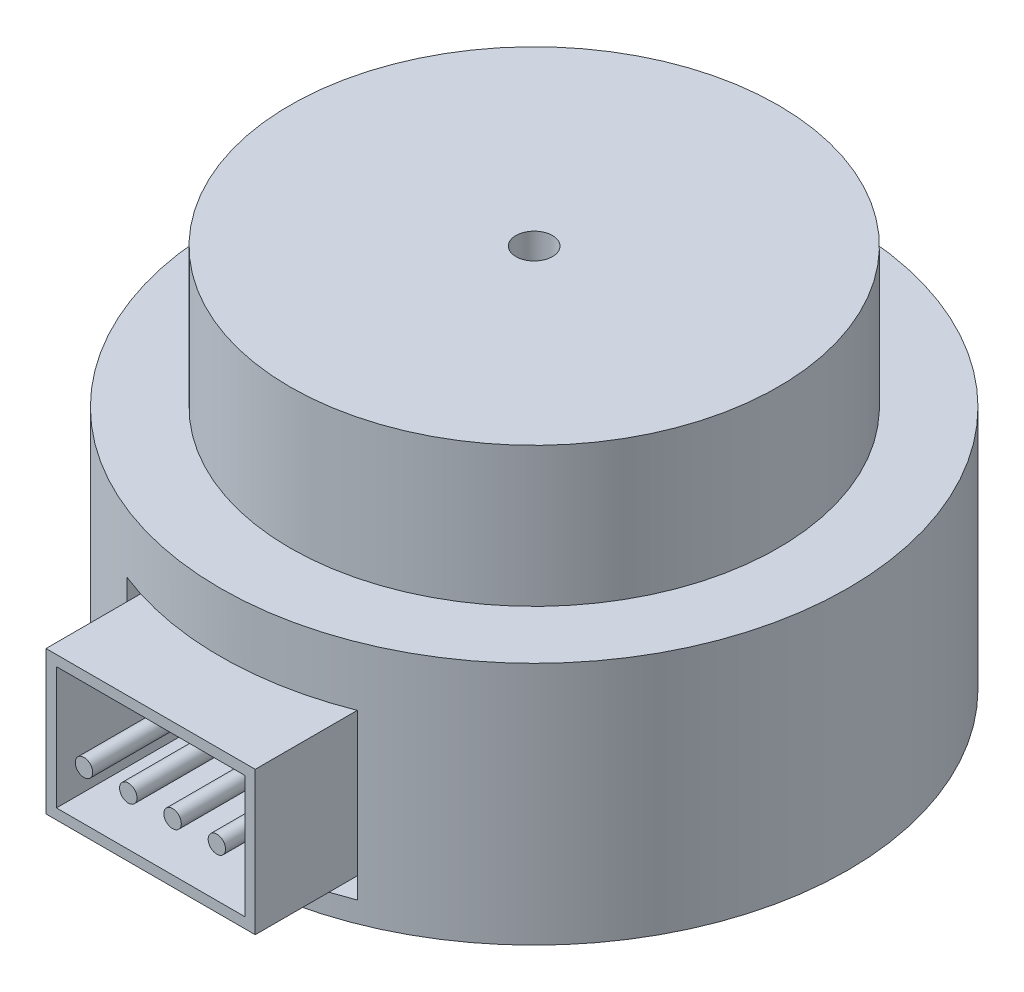
from build123d import *

# Parameters (mm, degrees)
BOSS_EXTRU_1_DEPTH           = 2
BOSS_EXTRU_1_DEPTH_BACK      = 0.528751
ESQUISSE2_W                  = 6
ESQUISSE2_H                  = 4.109563502
ENL_V_MAT_EXTRU_1_DEPTH      = 2
ENL_V_MAT_EXTRU_1_DEPTH_BACK = 2
ESQUISSE3_W                  = 6.6
ESQUISSE3_H                  = 4.709563502
ESQUISSE3_W_2                = 6
ESQUISSE3_H_2                = 4.109563502
ESQUISSE3_W_3                = 5.4
ESQUISSE3_H_3                = 3.509563502
ESQUISSE3_R                  = 0.25


with BuildPart() as part:
    # Esquisse1 → Révolution1 (revolve)
    with BuildSketch(Plane.XY):
        Polygon((-4.5, 0), (-9, 0), (-9, 7), (-7, 7), (-7, 11), (-0.525, 11), (-0.525, 3), (-4.5, 3), align=None)
    revolve(axis=Axis((0, 0, 0), (0, 1, 0)))

    # Esquisse2 → Boss.-Extru.1 (add, two sides: drawn at the far end of the back side and taken through both)
    with BuildSketch(Plane.XY.offset(9).offset(-BOSS_EXTRU_1_DEPTH_BACK)):
        with Locations((0, 2.950126619)):
            Rectangle(ESQUISSE2_W, ESQUISSE2_H)
    extrude(amount=BOSS_EXTRU_1_DEPTH + BOSS_EXTRU_1_DEPTH_BACK)

    # Esquisse3 → Enlèv. mat.-Extru.1 (cut, two sides: drawn at the far end of the back side and taken through both)
    # profile 1 of 2: a face of its own
    with BuildSketch(Plane.XY.offset(9).offset(-ENL_V_MAT_EXTRU_1_DEPTH_BACK)):
        with Locations((0, 2.950126619)):
            Rectangle(ESQUISSE3_W, ESQUISSE3_H)
        with Locations((0, 2.950126619)):
            Rectangle(ESQUISSE3_W_2, ESQUISSE3_H_2, mode=Mode.SUBTRACT)
    # profile 2 of 2: a face of its own
    with BuildSketch(Plane.XY.offset(9).offset(-ENL_V_MAT_EXTRU_1_DEPTH_BACK)):
        with Locations((0, 2.950126619)):
            Rectangle(ESQUISSE3_W_3, ESQUISSE3_H_3)
        with Locations((1.9, 2.595344868)):
            Circle(ESQUISSE3_R, mode=Mode.SUBTRACT)
        with Locations((0.629918036, 2.595344868)):
            Circle(ESQUISSE3_R, mode=Mode.SUBTRACT)
        with Locations((-0.640081964, 2.595344868)):
            Circle(ESQUISSE3_R, mode=Mode.SUBTRACT)
        with Locations((-1.910081964, 2.595344868)):
            Circle(ESQUISSE3_R, mode=Mode.SUBTRACT)
    extrude(amount=ENL_V_MAT_EXTRU_1_DEPTH + ENL_V_MAT_EXTRU_1_DEPTH_BACK, mode=Mode.SUBTRACT)


solid = part.part
